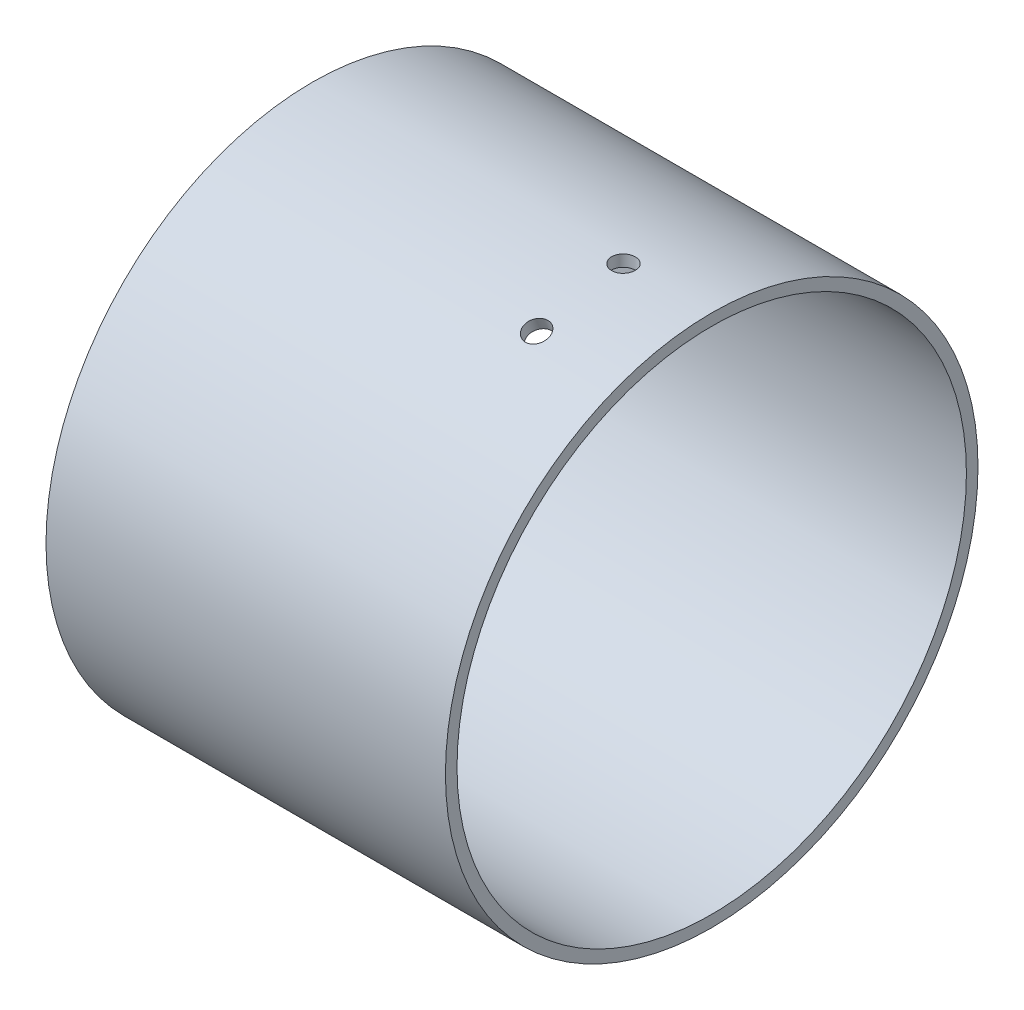
from build123d import *

# Parameters (mm, degrees)
SKETCH2_R                                 = 46
SKETCH2_R_2                               = 44
BOSS_EXTRUDE1_DEPTH                       = 69
F_20_0_161_DIAMETER_HOLE1_REACH           = 118.266
F_20_0_161_DIAMETER_HOLE1_BORE_R          = 2.0447
F_20_0_161_DIAMETER_HOLE1_ON_FACE_2_REACH = 123.078
F_20_0_161_DIAMETER_HOLE1_BORE_2_R        = 2.0447


with BuildPart() as part:
    # Sketch2 → Boss-Extrude1 (new body)
    with BuildSketch(Plane(origin=(0, 0, 0), x_dir=(0, 0, -1), z_dir=(1, 0, 0))):
        Circle(SKETCH2_R)
        Circle(SKETCH2_R_2, mode=Mode.SUBTRACT)
    extrude(amount=BOSS_EXTRUDE1_DEPTH)

    # #20 (0.161) Diameter Hole1 bore (on position points) → #20 (0.161) Diameter Hole1 (cut, up to next)
    with BuildSketch(Plane(origin=(54, 45.999391106, 0.236680926), x_dir=(0, -0.00514523752, 0.999986763178), z_dir=(0, 0.999986763178, 0.00514523752)), mode=Mode.PRIVATE) as f_20_0_161_diameter_hole1_sk1:
        Circle(F_20_0_161_DIAMETER_HOLE1_BORE_R)
    f_20_0_161_diameter_hole1_tool1 = extrude(f_20_0_161_diameter_hole1_sk1.sketch, amount=-F_20_0_161_DIAMETER_HOLE1_REACH, mode=Mode.PRIVATE) & part.part
    add(f_20_0_161_diameter_hole1_tool1.solids().sort_by_distance((54, 45.999391, 0.236681))[0], mode=Mode.SUBTRACT)

    # #20 (0.161) Diameter Hole1 bore 2 (on position points) → #20 (0.161) Diameter Hole1 on face 2 (cut, up to next)
    with BuildSketch(Plane(origin=(54, 43.397555314, 15.252940464), x_dir=(0, -0.331585999002, 0.94342499716), z_dir=(0, 0.94342499716, 0.331585999002)), mode=Mode.PRIVATE) as f_20_0_161_diameter_hole1_on_face_2_sk1:
        Circle(F_20_0_161_DIAMETER_HOLE1_BORE_2_R)
    f_20_0_161_diameter_hole1_on_face_2_tool1 = extrude(f_20_0_161_diameter_hole1_on_face_2_sk1.sketch, amount=-F_20_0_161_DIAMETER_HOLE1_ON_FACE_2_REACH, mode=Mode.PRIVATE) & part.part
    add(f_20_0_161_diameter_hole1_on_face_2_tool1.solids().sort_by_distance((54, 43.397555, 15.25294))[0], mode=Mode.SUBTRACT)


solid = part.part
